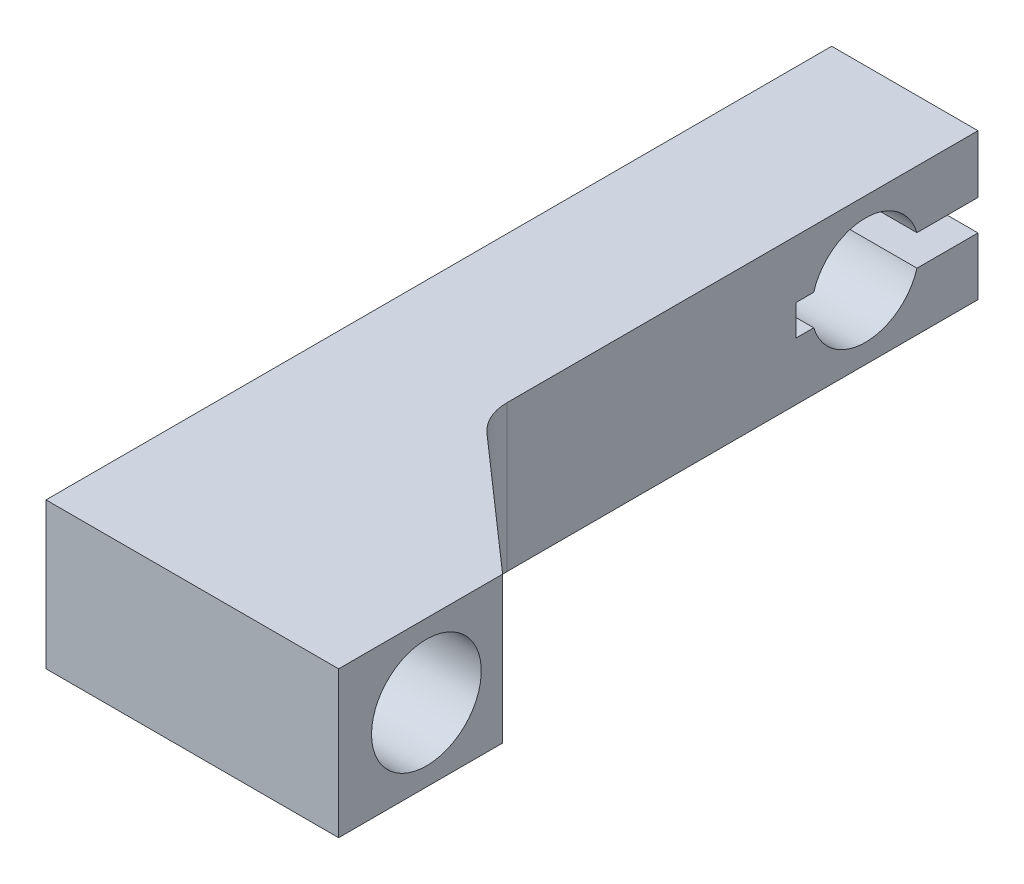
from build123d import *

# Parameters (mm, degrees)
SKETCH1_R           = 14.2875
BOSS_EXTRUDE1_DEPTH = 38.1
SKETCH2_W           = 76.2
SKETCH2_H           = 38.1
SKETCH2_R           = 14.2875
BOSS_EXTRUDE2_DEPTH = 38.1
CUT_EXTRUDE1_DEPTH  = 38.1
FILLET1_R           = 12.7


with BuildPart() as part:
    # Sketch1 → Boss-Extrude1 (new body)
    with BuildSketch(Plane(origin=(0, 0, 0), x_dir=(0, 0, -1), z_dir=(1, 0, 0))):
        with BuildLine():
            Line((29.337186502, -19.05), (-175.255687154, -19.05))
            Line((-175.255687154, -19.05), (-175.255687154, 19.05))
            Line((-175.255687154, 19.05), (29.337186502, 19.05))
            Line((29.337186502, 19.05), (29.337186502, 4))
            Line((29.337186502, 4), (13.442493258, 4))
            ThreePointArc((13.442493258, 4), (0, 14.025), (-13.442493258, 4))
            Line((-13.442493258, 4), (-18.025, 4))
            Line((-18.025, 4), (-18.025, -4))
            Line((-18.025, -4), (-13.442493258, -4))
            ThreePointArc((-13.442493258, -4), (0, -14.025), (13.442493258, -4))
            Line((13.442493258, -4), (29.337186502, -4))
            Line((29.337186502, -4), (29.337186502, -19.05))
        make_face()
        with Locations(Location((-152.4, 0, 0), (0, 0, 180))):
            Circle(SKETCH1_R, mode=Mode.SUBTRACT)
    extrude(amount=BOSS_EXTRUDE1_DEPTH)

    # Sketch2 → Boss-Extrude2 (add)
    with BuildSketch(Plane(origin=(38.1, 0, 0), x_dir=(0, 0, -1), z_dir=(1, 0, 0))):
        with Locations((-137.155687154, 0)):
            Rectangle(SKETCH2_W, SKETCH2_H)
        with Locations(Location((-152.4, 0, 0), (0, 0, 180))):
            Circle(SKETCH2_R, mode=Mode.SUBTRACT)
    extrude(amount=BOSS_EXTRUDE2_DEPTH)

    # Sketch3 → Cut-Extrude1 (cut)
    with BuildSketch(Plane(origin=(0, 19.05, 0), x_dir=(1, 0, 0), z_dir=(0, 1, 0))):
        Polygon((38.1, -99.055687154), (76.2, -132.562404594), (94.277321555, -84.449227978), align=None)
    extrude(amount=-CUT_EXTRUDE1_DEPTH, mode=Mode.SUBTRACT)

    # Fillet1
    fillet1_edges = [part.edges().sort_by_distance(p)[0] for p in [
        (38.1, 0, 99.055687154),
    ]]
    fillet(fillet1_edges, radius=FILLET1_R)


solid = part.part
